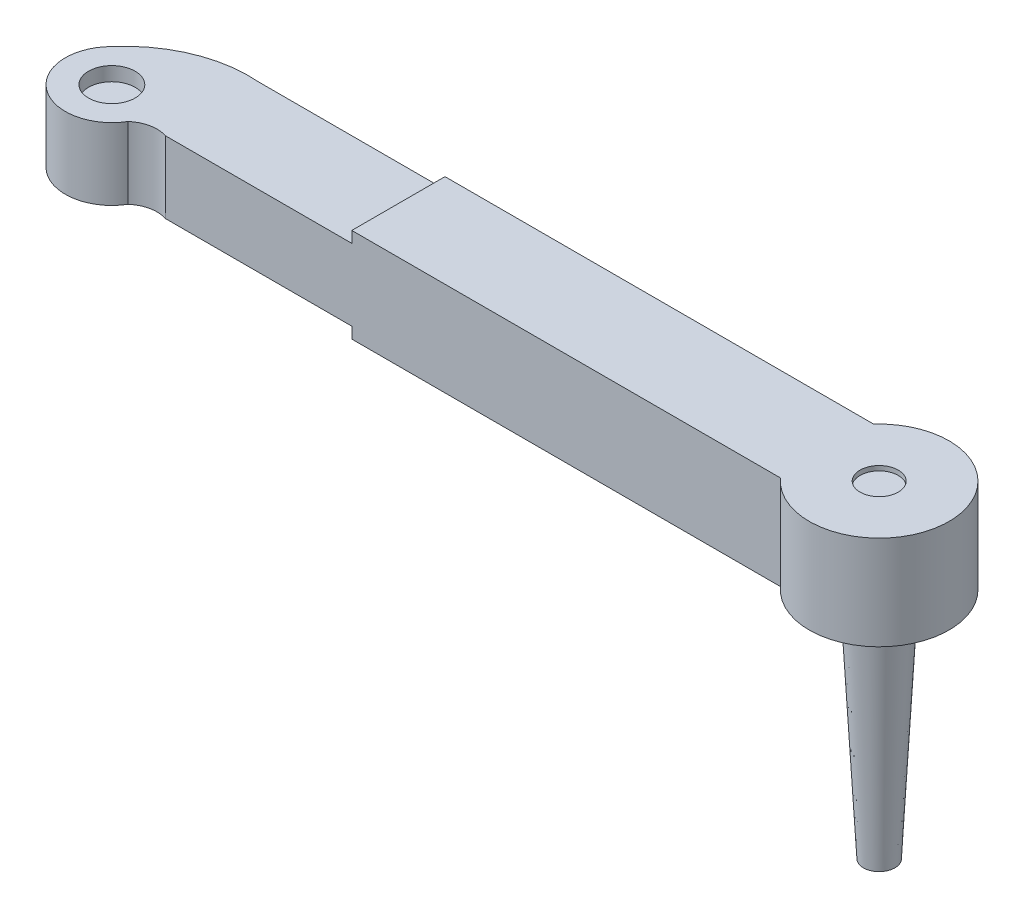
from build123d import *

# Parameters (mm, degrees)
SALIENTE_EXTRUIR1_DEPTH = 10.1
CROQUIS2_R              = 2.05
CORTAR_EXTRUIR1_DEPTH   = 0.5
CROQUIS3_W              = 20
CROQUIS3_H              = 1.2
CORTAR_EXTRUIR2_DEPTH   = 49.811512632
SALIENTE_EXTRUIR3_START = -7.7
SALIENTE_EXTRUIR3_DEPTH = 7.7
CROQUIS7_R              = 2.5
CORTAR_EXTRUIR4_DEPTH   = 1.5
CROQUIS8_R              = 3
SALIENTE_EXTRUIR4_DEPTH = 25
SALIENTE_EXTRUIR4_TAPER = 3


with BuildPart() as part:
    # Croquis1 → Saliente-Extruir1 (new body)
    with BuildSketch(Plane(origin=(0, 0, 0), x_dir=(1, 0, 0), z_dir=(0, 1, 0))):
        with BuildLine():
            Line((-33, -5), (33, -5))
            ThreePointArc((33, -5), (46.090169944, 0), (33, 5))
            Line((33, 5), (-33, 5))
            Line((-33, 5), (-33, -5))
        make_face()
    extrude(amount=SALIENTE_EXTRUIR1_DEPTH)

    # Croquis2 → Cortar-Extruir1 (cut)
    with BuildSketch(Plane(origin=(0, 10.1, 0), x_dir=(1, 0, 0), z_dir=(0, 1, 0))):
        with Locations(Location((38.590169944, 0, 0), (0, 0, 270))):
            Circle(CROQUIS2_R)
    extrude(amount=-CORTAR_EXTRUIR1_DEPTH, mode=Mode.SUBTRACT)

    # Croquis3 → Cortar-Extruir2 (cut, through all)
    with BuildSketch(Plane.XY.offset(5)):
        with Locations((-23, 9.5)):
            Rectangle(CROQUIS3_W, CROQUIS3_H)
    cortar_extruir2 = extrude(amount=-CORTAR_EXTRUIR2_DEPTH, mode=Mode.SUBTRACT)

    # Simetría1: Cortar-Extruir2 across plane
    add(cortar_extruir2.mirror(Plane.ZX.offset(5.05)), mode=Mode.SUBTRACT)

    # Croquis6 → Saliente-Extruir3 (add)
    with BuildSketch(Plane(origin=(0, 8.9, 0), x_dir=(1, 0, 0), z_dir=(0, 1, 0)).offset(SALIENTE_EXTRUIR3_START)):
        with BuildLine():
            Line((-33, 5), (-33, -5))
            ThreePointArc((-33, -5), (-34.754979339, -4.897304712), (-36.330136848, -5.677931145))
            ThreePointArc((-36.330136848, -5.677931145), (-43.699538391, -7.061851575), (-44.148390874, 0.422922724))
            ThreePointArc((-44.148390874, 0.422922724), (-39.122361815, 4.046630659), (-33, 5))
        make_face()
    extrude(amount=SALIENTE_EXTRUIR3_DEPTH)

    # Croquis7 → Cortar-Extruir4 (cut)
    with BuildSketch(Plane(origin=(0, 8.9, 0), x_dir=(1, 0, 0), z_dir=(0, 1, 0))):
        with Locations(Location((-40.624839531, -3.12162005, 0), (0, 0, 270))):
            Circle(CROQUIS7_R)
    cortar_extruir4 = extrude(amount=-CORTAR_EXTRUIR4_DEPTH, mode=Mode.SUBTRACT)

    # Simetría3: Cortar-Extruir4 across plane
    add(cortar_extruir4.mirror(Plane.ZX.offset(5.05)), mode=Mode.SUBTRACT)

    # Croquis8 → Saliente-Extruir4 (add)
    with BuildSketch(Plane.XZ):
        with Locations((38.590169944, 0)):
            Circle(CROQUIS8_R)
    extrude(amount=SALIENTE_EXTRUIR4_DEPTH, taper=SALIENTE_EXTRUIR4_TAPER)


solid = part.part
